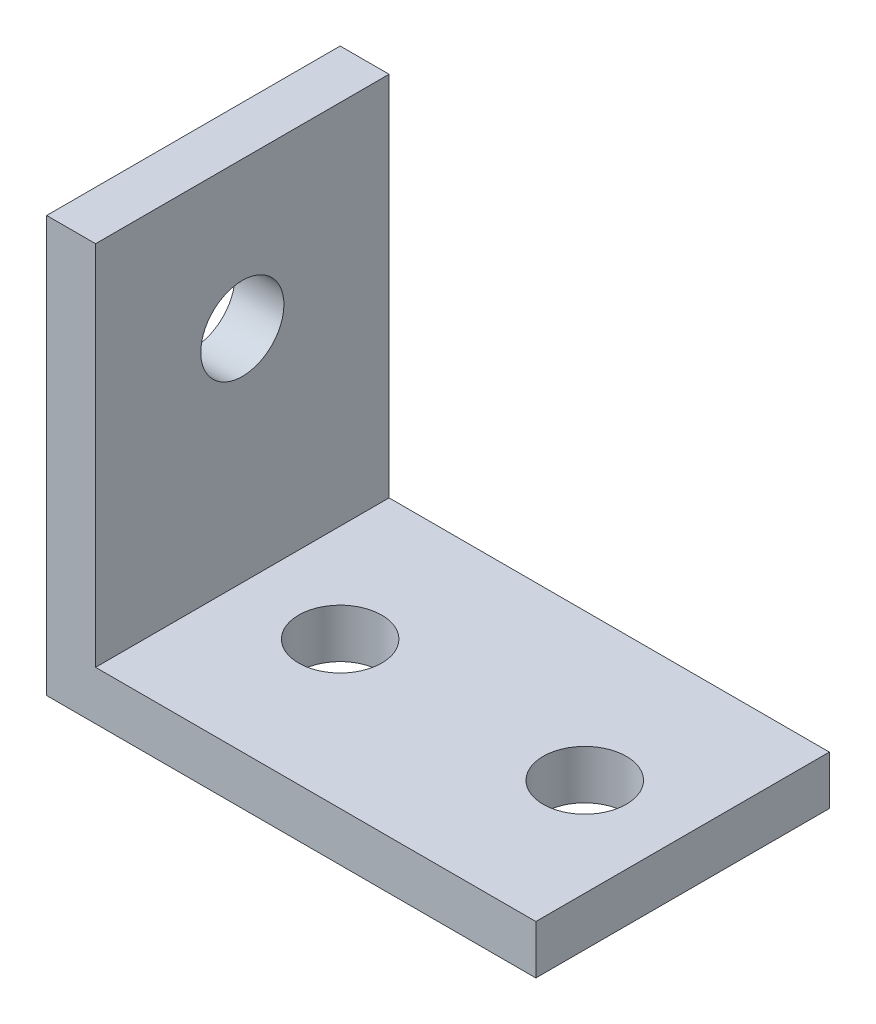
from build123d import *

# Parameters (mm, degrees)
BOSS_EXTRUDE2_DEPTH = 6
SKETCH4_R           = 0.85
CUT_EXTRUDE1_DEPTH  = 6
SKETCH6_R           = 0.85
CUT_EXTRUDE2_DEPTH  = 6


with BuildPart() as part:
    # Sketch3 → Boss-Extrude2 (new body)
    with BuildSketch(Plane.XY):
        Polygon((0, 0), (10, 0), (10, 1), (1, 1), (1, 8.5), (0, 8.5), align=None)
    extrude(amount=BOSS_EXTRUDE2_DEPTH)

    # Sketch4 → Cut-Extrude1 (cut)
    with BuildSketch(Plane(origin=(1, 0, 0), x_dir=(0, 0, -1), z_dir=(1, 0, 0))):
        with Locations(Location((-3, 5.5, 0), (0, 0, 90))):
            Circle(SKETCH4_R)
    extrude(amount=-CUT_EXTRUDE1_DEPTH, mode=Mode.SUBTRACT)

    # Sketch6 → Cut-Extrude2 (cut)
    with BuildSketch(Plane(origin=(0, 1, 0), x_dir=(1, 0, 0), z_dir=(0, 1, 0))):
        with Locations(Location((3, -3, 0), (0, 0, 180))):
            Circle(SKETCH6_R)
        with Locations(Location((8, -3, 0), (0, 0, 180))):
            Circle(SKETCH6_R)
    extrude(amount=-CUT_EXTRUDE2_DEPTH, mode=Mode.SUBTRACT)


solid = part.part
